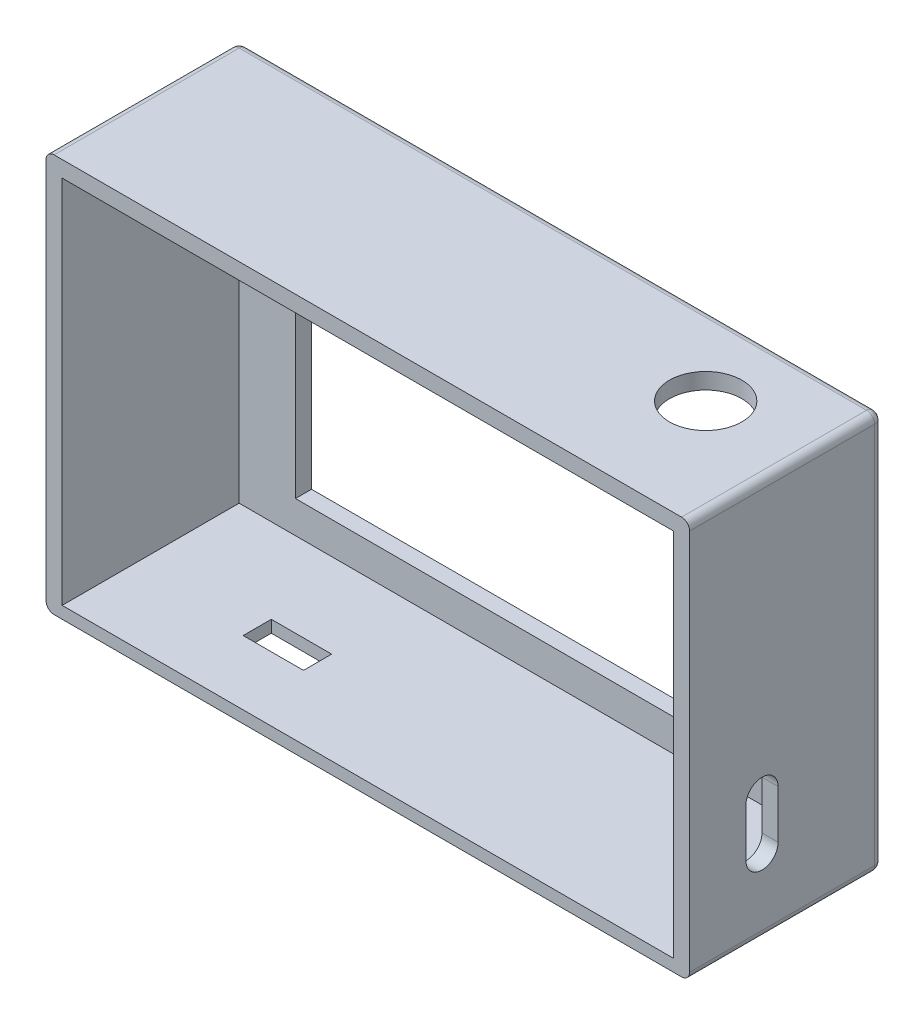
from build123d import *

# Parameters (mm, degrees)
SKETCH_1_W           = 80
SKETCH_1_H           = 51.5
SKETCH_1_W_2         = 76
SKETCH_1_H_2         = 50.5
EXTRUDE_1_DEPTH      = 22
SKETCH_2_W           = 80
SKETCH_2_H           = 51.5
EXTRUDE_2_DEPTH      = 2
CUT_EXTRUDE_1_REACH  = 88.874
CUT_EXTRUDE_2_REACH  = 70.82
SKETCH_6_W           = 7.5
SKETCH_6_H           = 3.5
CUT_EXTRUDE_3_REACH  = 70.82
SKETCH_7_W           = 76
SKETCH_7_H           = 20
SKETCH_8_W           = 80
SKETCH_8_H           = 51.5
EXTRUDE_3_DEPTH      = 2
SKETCH_9_W           = 62
SKETCH_9_H           = 36
CUT_EXTRUDE_4_DEPTH  = 2
SKETCH_15_W          = 80
SKETCH_15_H          = 24
EXTRUDE_5_DEPTH      = 1
SKETCH_16_W          = 7.5
SKETCH_16_H          = 3.5
CUT_EXTRUDE_6_DEPTH  = 1
SKETCH_17_W          = 62
SKETCH_17_H          = 2
CUT_EXTRUDE_7_DEPTH  = 2
SKETCH_19_W          = 80
SKETCH_19_H          = 24
CUT_EXTRUDE_8_DEPTH  = 3
SKETCH_20_W          = 76
SKETCH_20_H          = 2
EXTRUDE_6_DEPTH      = 20
SKETCH_21_W          = 76
SKETCH_21_H          = 46
CUT_EXTRUDE_9_DEPTH  = 10
FILLET_1_R           = 1
SKETCH_22_R          = 4.5
CUT_EXTRUDE_10_DEPTH = 10
SKETCH_23_W          = 62
SKETCH_23_H          = 0.5
CUT_EXTRUDE_11_DEPTH = 10


with BuildPart() as part:
    # 草图1 → 凸台-拉伸1 (new body)
    with BuildSketch(Plane.XY):
        Rectangle(SKETCH_1_W, SKETCH_1_H)
        Rectangle(SKETCH_1_W_2, SKETCH_1_H_2, mode=Mode.SUBTRACT)
    extrude(amount=EXTRUDE_1_DEPTH)

    # 草图2 → 凸台-拉伸2 (add)
    with BuildSketch(Plane.XY.offset(22)):
        Rectangle(SKETCH_2_W, SKETCH_2_H)
    extrude(amount=-EXTRUDE_2_DEPTH)

    # 草图4 → 切除-拉伸1 (cut, up to next)
    with BuildSketch(Plane(origin=(40, 0, 0), x_dir=(0, 0, -1), z_dir=(1, 0, 0)), mode=Mode.PRIVATE) as cut_extrude_1_sk1:
        with BuildLine():
            Line((-11, -11.25), (-11, -17.25))
            ThreePointArc((-11, -17.25), (-13, -19.25), (-15, -17.25))
            Line((-15, -17.25), (-15, -11.25))
            ThreePointArc((-15, -11.25), (-13, -9.25), (-11, -11.25))
        make_face()
    cut_extrude_1_tool1 = extrude(cut_extrude_1_sk1.sketch, amount=-CUT_EXTRUDE_1_REACH, mode=Mode.PRIVATE) & part.part
    add(cut_extrude_1_tool1.solids().sort_by_distance((40, -14.25, 13))[0], mode=Mode.SUBTRACT)

    # 草图6 → 切除-拉伸2 (cut, up to next)
    with BuildSketch(Plane.XZ.offset(25.75), mode=Mode.PRIVATE) as cut_extrude_2_sk1:
        with Locations((-19.75, 12.25)):
            Rectangle(SKETCH_6_W, SKETCH_6_H)
    cut_extrude_2_tool1 = extrude(cut_extrude_2_sk1.sketch, amount=-CUT_EXTRUDE_2_REACH, mode=Mode.PRIVATE) & part.part
    add(cut_extrude_2_tool1.solids().sort_by_distance((-19.75, -25.75, 12.25))[0], mode=Mode.SUBTRACT)

    # 草图7 → 切除-拉伸3 (cut, up to next)
    with BuildSketch(Plane(origin=(0, 25.75, 0), x_dir=(1, 0, 0), z_dir=(0, 1, 0)), mode=Mode.PRIVATE) as cut_extrude_3_sk1:
        with Locations((0, -10)):
            Rectangle(SKETCH_7_W, SKETCH_7_H)
    cut_extrude_3_tool1 = extrude(cut_extrude_3_sk1.sketch, amount=-CUT_EXTRUDE_3_REACH, mode=Mode.PRIVATE) & part.part
    add(cut_extrude_3_tool1.solids().sort_by_distance((0, 25.75, 10))[0], mode=Mode.SUBTRACT)

    # 草图8 → 凸台-拉伸3 (add)
    with BuildSketch(Plane(origin=(0, 0, 0), x_dir=(-1, 0, 0), z_dir=(0, 0, -1))):
        Rectangle(SKETCH_8_W, SKETCH_8_H)
    extrude(amount=EXTRUDE_3_DEPTH)

    # 草图9 → 切除-拉伸4 (cut)
    with BuildSketch(Plane(origin=(0, 0, -2), x_dir=(-1, 0, 0), z_dir=(0, 0, -1))):
        with Locations((0, -1.25)):
            Rectangle(SKETCH_9_W, SKETCH_9_H)
    extrude(amount=-CUT_EXTRUDE_4_DEPTH, mode=Mode.SUBTRACT)

    # 草图15 → 凸台-拉伸5 (add)
    with BuildSketch(Plane.XZ.offset(25.75)):
        with Locations((0, 10)):
            Rectangle(SKETCH_15_W, SKETCH_15_H)
    extrude(amount=EXTRUDE_5_DEPTH)

    # 草图16 → 切除-拉伸6 (cut)
    with BuildSketch(Plane(origin=(0, -25.75, 0), x_dir=(1, 0, 0), z_dir=(0, 1, 0))):
        with Locations((-19.75, -12.25)):
            Rectangle(SKETCH_16_W, SKETCH_16_H)
    extrude(amount=-CUT_EXTRUDE_6_DEPTH, mode=Mode.SUBTRACT)

    # 草图17 → 切除-拉伸7 (cut)
    with BuildSketch(Plane(origin=(0, 0, -2), x_dir=(-1, 0, 0), z_dir=(0, 0, -1))):
        with Locations((0, -20.25)):
            Rectangle(SKETCH_17_W, SKETCH_17_H)
    extrude(amount=-CUT_EXTRUDE_7_DEPTH, mode=Mode.SUBTRACT)

    # 草图19 → 切除-拉伸8 (cut)
    with BuildSketch(Plane(origin=(0, 25.75, 0), x_dir=(1, 0, 0), z_dir=(0, 1, 0))):
        with Locations((0, -10)):
            Rectangle(SKETCH_19_W, SKETCH_19_H)
    extrude(amount=-CUT_EXTRUDE_8_DEPTH, mode=Mode.SUBTRACT)

    # 草图20 → 凸台-拉伸6 (add)
    with BuildSketch(Plane(origin=(0, 0, 20), x_dir=(-1, 0, 0), z_dir=(0, 0, -1))):
        with Locations((0, 21.75)):
            Rectangle(SKETCH_20_W, SKETCH_20_H)
    extrude(amount=EXTRUDE_6_DEPTH)

    # 草图21 → 切除-拉伸9 (cut)
    with BuildSketch(Plane(origin=(0, 0, 20), x_dir=(-1, 0, 0), z_dir=(0, 0, -1))):
        with Locations((0, -2.25)):
            Rectangle(SKETCH_21_W, SKETCH_21_H)
    extrude(amount=-CUT_EXTRUDE_9_DEPTH, mode=Mode.SUBTRACT)

    # 圆角1
    fillet_1_edges = [part.edges().sort_by_distance(p)[0] for p in [
        (-40, -26.75, 10),
        (0, -26.75, -2),
        (40, -26.75, 10),
        (40, -2, -2),
        (-40, 22.75, 10),
        (0, 22.75, -2),
        (40, 22.75, 10),
        (-40, -2, -2),
    ]]
    fillet(fillet_1_edges, radius=FILLET_1_R)

    # 草图22 → 切除-拉伸10 (cut)
    with BuildSketch(Plane(origin=(0, 22.75, 0), x_dir=(1, 0, 0), z_dir=(0, 1, 0))):
        with Locations(Location((28, -8, 0), (0, 0, 270))):
            Circle(SKETCH_22_R)
    extrude(amount=-CUT_EXTRUDE_10_DEPTH, mode=Mode.SUBTRACT)

    # 草图23 → 切除-拉伸11 (cut)
    with BuildSketch(Plane(origin=(0, 0, -2), x_dir=(-1, 0, 0), z_dir=(0, 0, -1))):
        with Locations((0, 17)):
            Rectangle(SKETCH_23_W, SKETCH_23_H)
    extrude(amount=-CUT_EXTRUDE_11_DEPTH, mode=Mode.SUBTRACT)


solid = part.part
